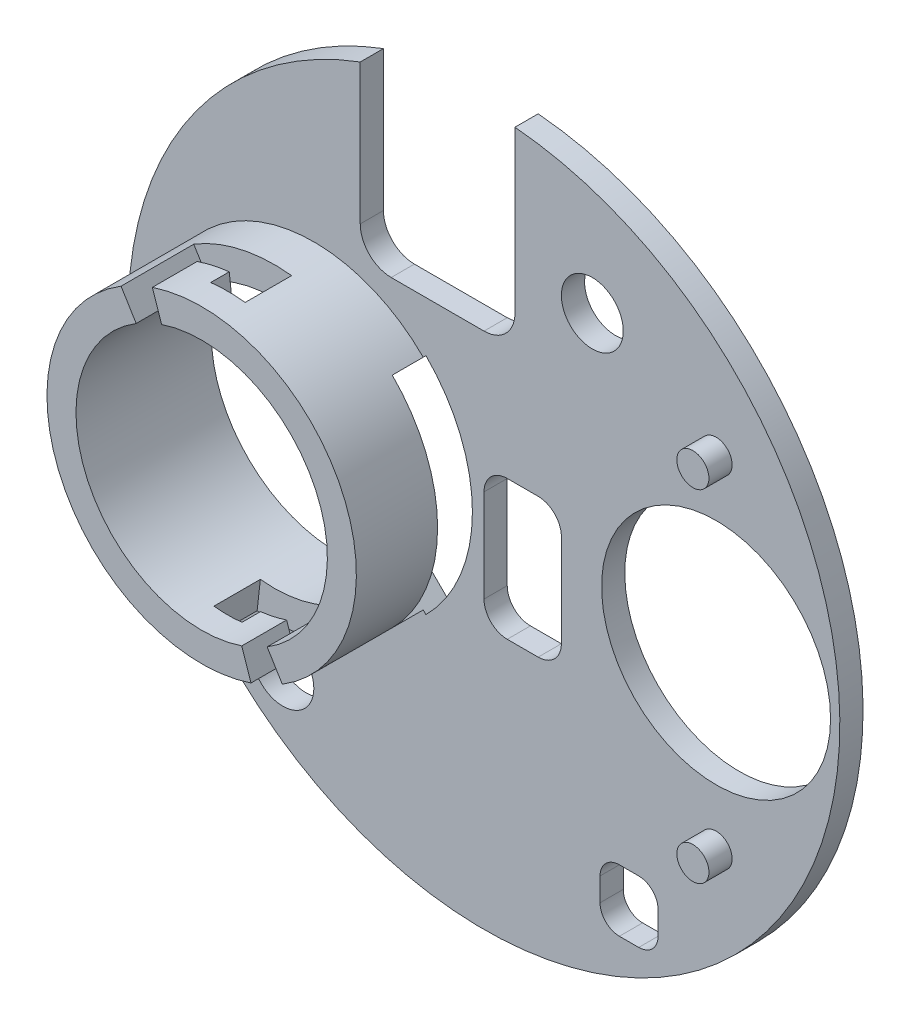
from build123d import *

# Parameters (mm, degrees)
SKETCH1_R                                           = 46
CAGE_PLATE_DEPTH                                    = 3
SKETCH2_R                                           = 20
SKETCH2_R_2                                         = 16.25
BAYONET_SOCKET_DEPTH                                = 14.5
SKETCH3_R                                           = 2.075
TURBIDITY_EAR_PINS_DEPTH                            = 3
HUB_BORE_AND_TURBIDITY_BORE_DEPTH                   = 127.008928255
HUB_BORE_AND_TURBIDITY_BORE_DEPTH_BACK              = 127.008928255
SKETCH4_R                                           = 16.25
SKETCH4_R_2                                         = 14.8
TDS_NOTCH_DS_HOLE_FLOW_WINDOW_HOSE_NOTCH_DEPTH      = 127.008928255
TDS_NOTCH_DS_HOLE_FLOW_WINDOW_HOSE_NOTCH_DEPTH_BACK = 127.008928255
SKETCH5_R                                           = 4
SKETCH5_W                                           = 12
SKETCH5_H                                           = 11
SKETCH6_R                                           = 2.15
POST_PIN_SOCKETS_BLIND_DEPTH                        = 1.6
HUB_CABLE_WINDOW_DEPTH                              = 3.75
J_ENTRY_SLOTS_DEPTH                                 = 4.95
J_TWIST_CHANNELS_DEPTH                              = 1.8
J_LOCK_NOTCHES_DEPTH                                = 3


with BuildPart() as part:
    # Sketch1 → Cage_plate (new body)
    with BuildSketch(Plane.XY.offset(-19.5)):
        with Locations((70, 0)):
            Circle(SKETCH1_R)
    extrude(amount=CAGE_PLATE_DEPTH)

    # Sketch2 → Bayonet_socket (add)
    with BuildSketch(Plane.XY.offset(-16.5)):
        with Locations(Location((48, 0, 0), (0, 0, 180))):
            Circle(SKETCH2_R)
        with Locations(Location((48, 0, 0), (0, 0, 180))):
            Circle(SKETCH2_R_2, mode=Mode.SUBTRACT)
    extrude(amount=BAYONET_SOCKET_DEPTH)

    # Sketch3 → Turbidity_ear_pins (add)
    with BuildSketch(Plane.XY.offset(-16.5)):
        with Locations((100, 22.05)):
            Circle(SKETCH3_R)
        with Locations((100, -22.05)):
            Circle(SKETCH3_R)
    extrude(amount=TURBIDITY_EAR_PINS_DEPTH)

    # Sketch4 → Hub_bore_and_turbidity_bore (cut, two sides: drawn at the far end of the back side and taken through both)
    with BuildSketch(Plane.XY.offset(-19.5).offset(-HUB_BORE_AND_TURBIDITY_BORE_DEPTH_BACK)):
        with Locations((48, 0)):
            Circle(SKETCH4_R)
        with Locations((100, 0)):
            Circle(SKETCH4_R_2)
    extrude(amount=HUB_BORE_AND_TURBIDITY_BORE_DEPTH + HUB_BORE_AND_TURBIDITY_BORE_DEPTH_BACK, mode=Mode.SUBTRACT)

    # Sketch5 → TDS_notch_DS_hole_flow_window_hose_notch (cut, two sides: drawn at the far end of the back side and taken through both)
    with BuildSketch(Plane.XY.offset(-19.5).offset(-TDS_NOTCH_DS_HOLE_FLOW_WINDOW_HOSE_NOTCH_DEPTH_BACK)):
        with Locations((84, 30)):
            Circle(SKETCH5_R)
        with Locations((44, -30)):
            Circle(SKETCH5_R)
        with BuildLine():
            Line((58, 21), (70, 21))
            ThreePointArc((70, 21), (72.828427125, 22.171572875), (74, 25))
            Line((74, 25), (74, 46))
            ThreePointArc((74, 46), (72.828427125, 48.828427125), (70, 50))
            Line((70, 50), (58, 50))
            ThreePointArc((58, 50), (55.171572875, 48.828427125), (54, 46))
            Line((54, 46), (54, 25))
            ThreePointArc((54, 25), (55.171572875, 22.171572875), (58, 21))
        make_face()
        with BuildLine():
            Line((87.5, -38), (90, -38))
            ThreePointArc((90, -38), (91.767766953, -37.267766953), (92.5, -35.5))
            Line((92.5, -35.5), (92.5, -32.5))
            ThreePointArc((92.5, -32.5), (91.767766953, -30.732233047), (90, -30))
            Line((90, -30), (87.5, -30))
            ThreePointArc((87.5, -30), (85.732233047, -30.732233047), (85, -32.5))
            Line((85, -32.5), (85, -35.5))
            ThreePointArc((85, -35.5), (85.732233047, -37.267766953), (87.5, -38))
        make_face()
        with BuildLine():
            Line((73, -12), (77, -12))
            ThreePointArc((77, -12), (79.121320344, -11.121320344), (80, -9))
            Line((80, -9), (80, 3))
            ThreePointArc((80, 3), (79.121320344, 5.121320344), (77, 6))
            Line((77, 6), (73, 6))
            ThreePointArc((73, 6), (70.878679656, 5.121320344), (70, 3))
            Line((70, 3), (70, -9))
            ThreePointArc((70, -9), (70.878679656, -11.121320344), (73, -12))
        make_face()
        with Locations((26, -18.5)):
            Rectangle(SKETCH5_W, SKETCH5_H)
    extrude(amount=TDS_NOTCH_DS_HOLE_FLOW_WINDOW_HOSE_NOTCH_DEPTH + TDS_NOTCH_DS_HOLE_FLOW_WINDOW_HOSE_NOTCH_DEPTH_BACK, mode=Mode.SUBTRACT)

    # Sketch6 → Post_pin_sockets_blind (cut, symmetric)
    with BuildSketch(Plane.XY.offset(-18.4)):
        with Locations((30, 7)):
            Circle(SKETCH6_R)
        with Locations((30, -7)):
            Circle(SKETCH6_R)
        with Locations((106, 17)):
            Circle(SKETCH6_R)
        with Locations((106, -17)):
            Circle(SKETCH6_R)
    extrude(amount=POST_PIN_SOCKETS_BLIND_DEPTH, both=True, mode=Mode.SUBTRACT)

    # Sketch7 → Hub_cable_window (cut, symmetric)
    with BuildSketch(Plane.XY.offset(-16.25)):
        with BuildLine():
            Line((59.207642482, -11.207642482), (62.495689014, -14.495689014))
            ThreePointArc((62.495689014, -14.495689014), (68.5, 0), (62.495689014, 14.495689014))
            Line((62.495689014, 14.495689014), (59.207642482, 11.207642482))
            ThreePointArc((59.207642482, 11.207642482), (63.85, 0), (59.207642482, -11.207642482))
        make_face()
    extrude(amount=HUB_CABLE_WINDOW_DEPTH, both=True, mode=Mode.SUBTRACT)

    # Sketch8 → J_entry_slots (cut, symmetric)
    with BuildSketch(Plane.XY.offset(-6.45)):
        with BuildLine():
            Line((42.928546982, 15.069517719), (41.461334159, 19.429252405))
            ThreePointArc((41.461334159, 19.429252405), (39.336325634, 18.579309634), (37.319302547, 17.497791344))
            Line((37.319302547, 17.497791344), (39.715946854, 13.571457677))
            ThreePointArc((39.715946854, 13.571457677), (41.280369638, 14.410293814), (42.928546982, 15.069517719))
        make_face()
        with BuildLine():
            Line((53.071453018, -15.069517719), (54.538665841, -19.429252405))
            ThreePointArc((54.538665841, -19.429252405), (56.663674366, -18.579309634), (58.680697453, -17.497791344))
            Line((58.680697453, -17.497791344), (56.284053146, -13.571457677))
            ThreePointArc((56.284053146, -13.571457677), (54.719630362, -14.410293814), (53.071453018, -15.069517719))
        make_face()
    extrude(amount=J_ENTRY_SLOTS_DEPTH, both=True, mode=Mode.SUBTRACT)

    # Sketch9 → J_twist_channels (cut, symmetric)
    with BuildSketch(Plane.XY.offset(-9.6)):
        with BuildLine():
            Line((49.772356022, 15.800909915), (50.28511311, 20.372242343))
            ThreePointArc((50.28511311, 20.372242343), (43.562987914, 20.014068146), (37.319302547, 17.497791344))
            Line((37.319302547, 17.497791344), (39.715946854, 13.571457677))
            ThreePointArc((39.715946854, 13.571457677), (44.558610138, 15.523106513), (49.772356022, 15.800909915))
        make_face()
        with BuildLine():
            Line((46.227643978, -15.800909915), (45.71488689, -20.372242343))
            ThreePointArc((45.71488689, -20.372242343), (52.437012086, -20.014068146), (58.680697453, -17.497791344))
            Line((58.680697453, -17.497791344), (56.284053146, -13.571457677))
            ThreePointArc((56.284053146, -13.571457677), (51.441389862, -15.523106513), (46.227643978, -15.800909915))
        make_face()
    extrude(amount=J_TWIST_CHANNELS_DEPTH, both=True, mode=Mode.SUBTRACT)

    # Sketch10 → J_lock_notches (cut, symmetric)
    with BuildSketch(Plane.XY.offset(-8.4)):
        with BuildLine():
            Line((49.772356022, 15.800909915), (50.28511311, 20.372242343))
            ThreePointArc((50.28511311, 20.372242343), (48, 20.5), (45.71488689, 20.372242343))
            Line((45.71488689, 20.372242343), (46.227643978, 15.800909915))
            ThreePointArc((46.227643978, 15.800909915), (48, 15.9), (49.772356022, 15.800909915))
        make_face()
        with BuildLine():
            Line((46.227643978, -15.800909915), (45.71488689, -20.372242343))
            ThreePointArc((45.71488689, -20.372242343), (48, -20.5), (50.28511311, -20.372242343))
            Line((50.28511311, -20.372242343), (49.772356022, -15.800909915))
            ThreePointArc((49.772356022, -15.800909915), (48, -15.9), (46.227643978, -15.800909915))
        make_face()
    extrude(amount=J_LOCK_NOTCHES_DEPTH, both=True, mode=Mode.SUBTRACT)


solid = part.part
